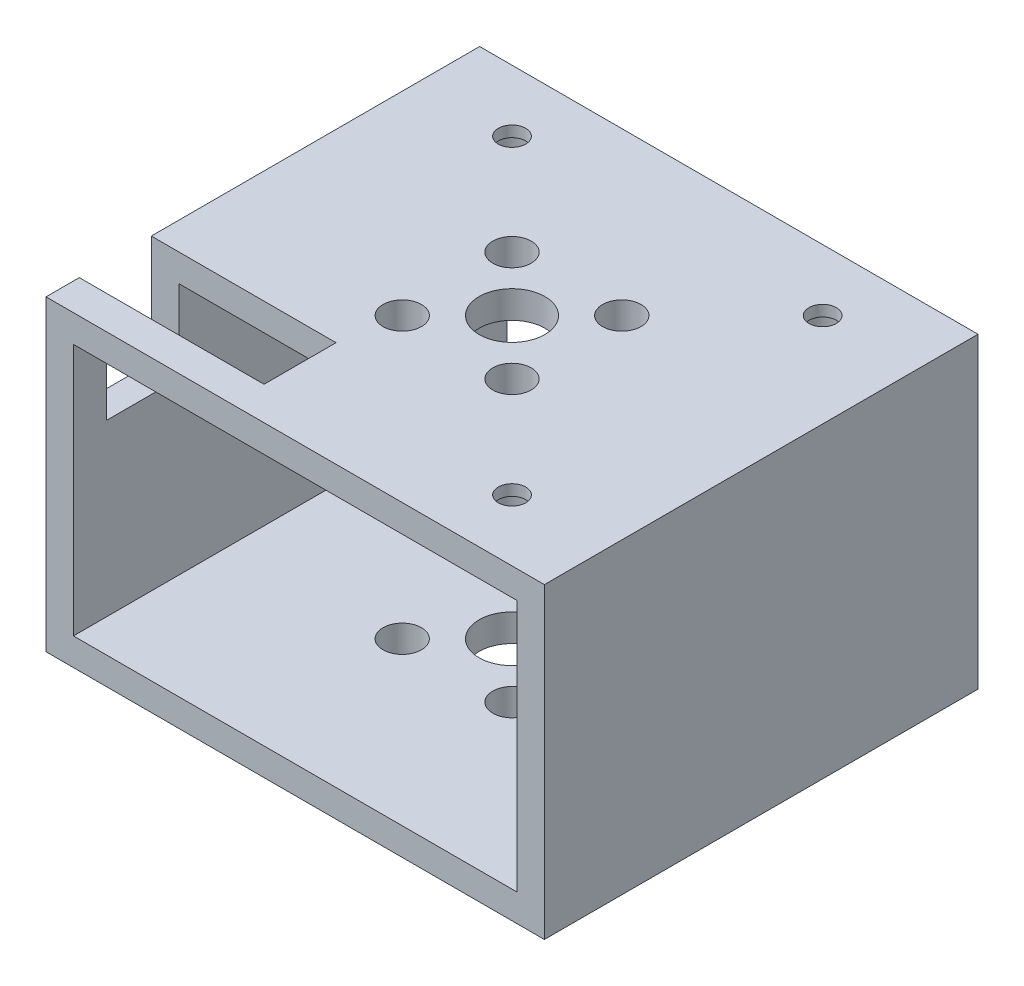
from build123d import *

# Parameters (mm, degrees)
SKETCH_1_W           = 50
SKETCH_1_H           = 39.5
SKETCH_1_R           = 1.51
SKETCH_1_R_2         = 1.75
SKETCH_1_R_3         = 3
EXTRUDE_1_DEPTH      = 2.5
SKETCH_2_W           = 2
SKETCH_2_H           = 39.5
EXTRUDE_6_DEPTH      = 28
SKETCH_3_W           = 50
SKETCH_3_H           = 39.5
SKETCH_3_R           = 1.75
SKETCH_3_R_2         = 3
SKETCH_3_R_3         = 1.51
EXTRUDE_7_DEPTH      = 2.5
SKETCH_4_W           = 16.941744986
SKETCH_4_H           = 9.266793399
CUT_EXTRUDE_1_DEPTH  = 10
SKETCH_5_W           = 6.8
SKETCH_5_H           = 39.5
EXTRUDE_8_DEPTH      = 29
SKETCH_6_OUTSIDE_W   = 70.584
SKETCH_6_OUTSIDE_H   = 45.584
SKETCH_6_OUTSIDE_W_2 = 45.4
SKETCH_6_OUTSIDE_H_2 = 28
CUT_EXTRUDE_2_DEPTH  = 55.217155956
SKETCH_7_R           = 1.25
CUT_EXTRUDE_3_DEPTH  = 10
SKETCH_8_R           = 2
CUT_EXTRUDE_4_DEPTH  = 1.5
SKETCH_9_W           = 16.827913255
SKETCH_9_H           = 6.559808616
CUT_EXTRUDE_5_DEPTH  = 10


with BuildPart() as part:
    # 草图1 → 凸台-拉伸1 (new body)
    with BuildSketch(Plane(origin=(0, 0, 0), x_dir=(1, 0, 0), z_dir=(0, 1, 0))):
        Rectangle(SKETCH_1_W, SKETCH_1_H)
        with Locations(Location((22.5, 9.75, 0), (0, 0, 270))):
            Circle(SKETCH_1_R, mode=Mode.SUBTRACT)
        with Locations(Location((-22.5, 9.75, 0), (0, 0, 270))):
            Circle(SKETCH_1_R, mode=Mode.SUBTRACT)
        with Locations(Location((-5, -5, 0), (0, 0, 270))):
            Circle(SKETCH_1_R_2, mode=Mode.SUBTRACT)
        with Locations(Location((5, -5, 0), (0, 0, 270))):
            Circle(SKETCH_1_R_2, mode=Mode.SUBTRACT)
        with Locations(Location((5, 5, 0), (0, 0, 270))):
            Circle(SKETCH_1_R_2, mode=Mode.SUBTRACT)
        with Locations(Location((-5, 5, 0), (0, 0, 270))):
            Circle(SKETCH_1_R_2, mode=Mode.SUBTRACT)
        with Locations(Location((0, 0, 0), (0, 0, 270))):
            Circle(SKETCH_1_R_3, mode=Mode.SUBTRACT)
        with Locations(Location((22.5, -9.75, 0), (0, 0, 270))):
            Circle(SKETCH_1_R, mode=Mode.SUBTRACT)
        with Locations(Location((-22.5, -9.75, 0), (0, 0, 270))):
            Circle(SKETCH_1_R, mode=Mode.SUBTRACT)
    extrude(amount=EXTRUDE_1_DEPTH)

    # 草图2 → 凸台-拉伸6 (add)
    with BuildSketch(Plane(origin=(0, 2.5, 0), x_dir=(1, 0, 0), z_dir=(0, 1, 0))):
        with Locations((-26, 0)):
            Rectangle(SKETCH_2_W, SKETCH_2_H)
        with Locations((26, 0)):
            Rectangle(SKETCH_2_W, SKETCH_2_H)
    extrude(amount=-EXTRUDE_6_DEPTH)

    # 草图3 → 凸台-拉伸7 (add)
    with BuildSketch(Plane.XZ.offset(25.5)):
        Rectangle(SKETCH_3_W, SKETCH_3_H)
        with Locations(Location((-5, 5, 0), (0, 0, 90))):
            Circle(SKETCH_3_R, mode=Mode.SUBTRACT)
        with Locations(Location((5, 5, 0), (0, 0, 90))):
            Circle(SKETCH_3_R, mode=Mode.SUBTRACT)
        with Locations(Location((5, -5, 0), (0, 0, 90))):
            Circle(SKETCH_3_R, mode=Mode.SUBTRACT)
        with Locations(Location((-5, -5, 0), (0, 0, 90))):
            Circle(SKETCH_3_R, mode=Mode.SUBTRACT)
        with Locations(Location((0, 0, 0), (0, 0, 90))):
            Circle(SKETCH_3_R_2, mode=Mode.SUBTRACT)
        with Locations(Location((22.5, -9.75, 0), (0, 0, 90))):
            Circle(SKETCH_3_R_3, mode=Mode.SUBTRACT)
        with Locations(Location((-22.5, -9.75, 0), (0, 0, 90))):
            Circle(SKETCH_3_R_3, mode=Mode.SUBTRACT)
        with Locations(Location((-22.5, 9.75, 0), (0, 0, 90))):
            Circle(SKETCH_3_R_3, mode=Mode.SUBTRACT)
        with Locations(Location((22.5, 9.75, 0), (0, 0, 90))):
            Circle(SKETCH_3_R_3, mode=Mode.SUBTRACT)
    extrude(amount=-EXTRUDE_7_DEPTH)

    # 草图4 → 切除-拉伸1 (cut)
    with BuildSketch(Plane.XZ.offset(25.5)):
        with Locations((-10.403823263, -13.116741256)):
            Rectangle(SKETCH_4_W, SKETCH_4_H)
    extrude(amount=-CUT_EXTRUDE_1_DEPTH, mode=Mode.SUBTRACT)

    # 草图5 → 凸台-拉伸8 (add)
    with BuildSketch(Plane.XZ.offset(25.5)):
        with Locations((23.6, 0)):
            Rectangle(SKETCH_5_W, SKETCH_5_H)
        with Locations((-23.6, 0)):
            Rectangle(SKETCH_5_W, SKETCH_5_H)
    extrude(amount=-EXTRUDE_8_DEPTH)

    # 草图6 outside → 切除-拉伸2 (cut, through all)
    with BuildSketch(Plane.XY.offset(19.75)):
        with Locations((0, -11)):
            Rectangle(SKETCH_6_OUTSIDE_W, SKETCH_6_OUTSIDE_H)
        with Locations((0, -11.5)):
            Rectangle(SKETCH_6_OUTSIDE_W_2, SKETCH_6_OUTSIDE_H_2, mode=Mode.SUBTRACT)
    extrude(amount=-CUT_EXTRUDE_2_DEPTH, mode=Mode.SUBTRACT)

    # 草图7 → 切除-拉伸3 (cut)
    with BuildSketch(Plane(origin=(0, 2.5, 0), x_dir=(1, 0, 0), z_dir=(0, 1, 0))):
        with Locations(Location((14.15, 14.15, 0), (0, 0, 270))):
            Circle(SKETCH_7_R)
        with Locations(Location((14.15, -14.15, 0), (0, 0, 270))):
            Circle(SKETCH_7_R)
        with Locations(Location((-14.15, -14.15, 0), (0, 0, 270))):
            Circle(SKETCH_7_R)
        with Locations(Location((-14.15, 14.15, 0), (0, 0, 270))):
            Circle(SKETCH_7_R)
    extrude(amount=-CUT_EXTRUDE_3_DEPTH, mode=Mode.SUBTRACT)

    # 草图8 → 切除-拉伸4 (cut)
    with BuildSketch(Plane.XZ):
        with Locations(Location((-14.15, -14.15, 0), (0, 0, 270))):
            Circle(SKETCH_8_R)
        with Locations(Location((-14.15, 14.15, 0), (0, 0, 270))):
            Circle(SKETCH_8_R)
        with Locations(Location((14.15, 14.15, 0), (0, 0, 270))):
            Circle(SKETCH_8_R)
        with Locations(Location((14.15, -14.15, 0), (0, 0, 270))):
            Circle(SKETCH_8_R)
    extrude(amount=-CUT_EXTRUDE_4_DEPTH, mode=Mode.SUBTRACT)

    # 草图9 → 切除-拉伸5 (cut)
    with BuildSketch(Plane(origin=(0, 2.5, 0), x_dir=(1, 0, 0), z_dir=(0, 1, 0))):
        with Locations((-14.286043373, -13.437027327)):
            Rectangle(SKETCH_9_W, SKETCH_9_H)
    extrude(amount=-CUT_EXTRUDE_5_DEPTH, mode=Mode.SUBTRACT)


solid = part.part
